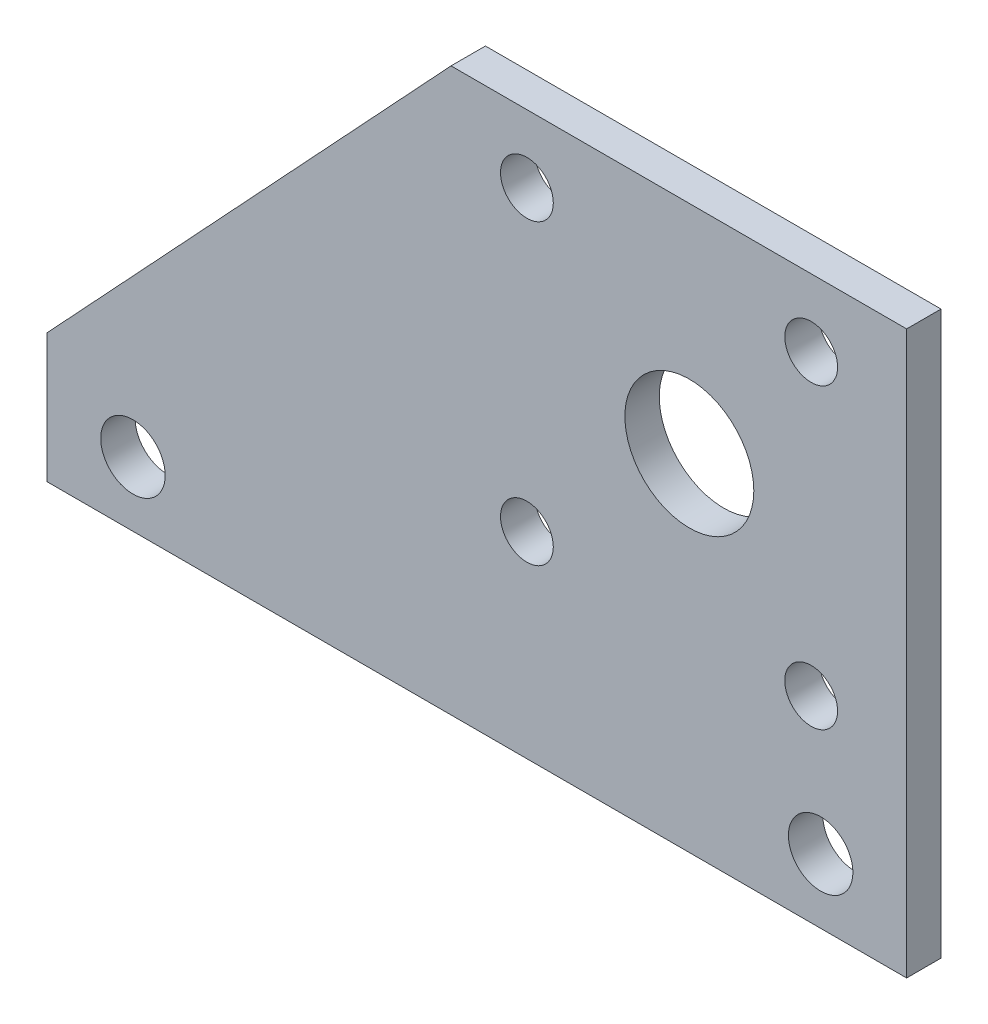
from build123d import *

# Parameters (mm, degrees)
SKETCH1_R                  = 2.38125
BOSS_EXTRUDE1_DEPTH        = 2.54
M3_5_CLEARANCE_HOLE1_D     = 3.9
M3_5_CLEARANCE_HOLE1_DEPTH = 12.7
M3_5_CLEARANCE_HOLE1_TIP   = 1.171678207
SKETCH5_R                  = 4.7625
CUT_EXTRUDE1_DEPTH         = 71.688752465


with BuildPart() as part:
    # Sketch1 → Boss-Extrude1 (new body)
    with BuildSketch(Plane.XY):
        Polygon((-6.35, 9.525), (23.496082005, 41.525), (57.15, 41.525), (57.15, 0), (44.45, 0), (6.35, 0), (-6.35, 0), align=None)
        with Locations((0, 4.7625)):
            Circle(SKETCH1_R, mode=Mode.SUBTRACT)
        with Locations((50.8, 4.7625)):
            Circle(SKETCH1_R, mode=Mode.SUBTRACT)
    extrude(amount=BOSS_EXTRUDE1_DEPTH)

    # M3.5 Clearance Hole1
    with Locations(Plane.XY.offset(2.54)):
        with Locations((29.1, 36.525), (50.1, 36.525), (50.1, 14.525), (29.1, 14.525)):
            Hole(M3_5_CLEARANCE_HOLE1_D / 2, depth=M3_5_CLEARANCE_HOLE1_DEPTH)
            with Locations((0, 0, -(M3_5_CLEARANCE_HOLE1_DEPTH + M3_5_CLEARANCE_HOLE1_TIP / 2))):  # 118° drill point
                Cone(0, M3_5_CLEARANCE_HOLE1_D / 2, M3_5_CLEARANCE_HOLE1_TIP, mode=Mode.SUBTRACT)

    # Sketch5 → Cut-Extrude1 (cut, through all)
    with BuildSketch(Plane.XY.offset(2.54)):
        with Locations((41.1, 25.525)):
            Circle(SKETCH5_R)
    extrude(amount=-CUT_EXTRUDE1_DEPTH, mode=Mode.SUBTRACT)


solid = part.part
